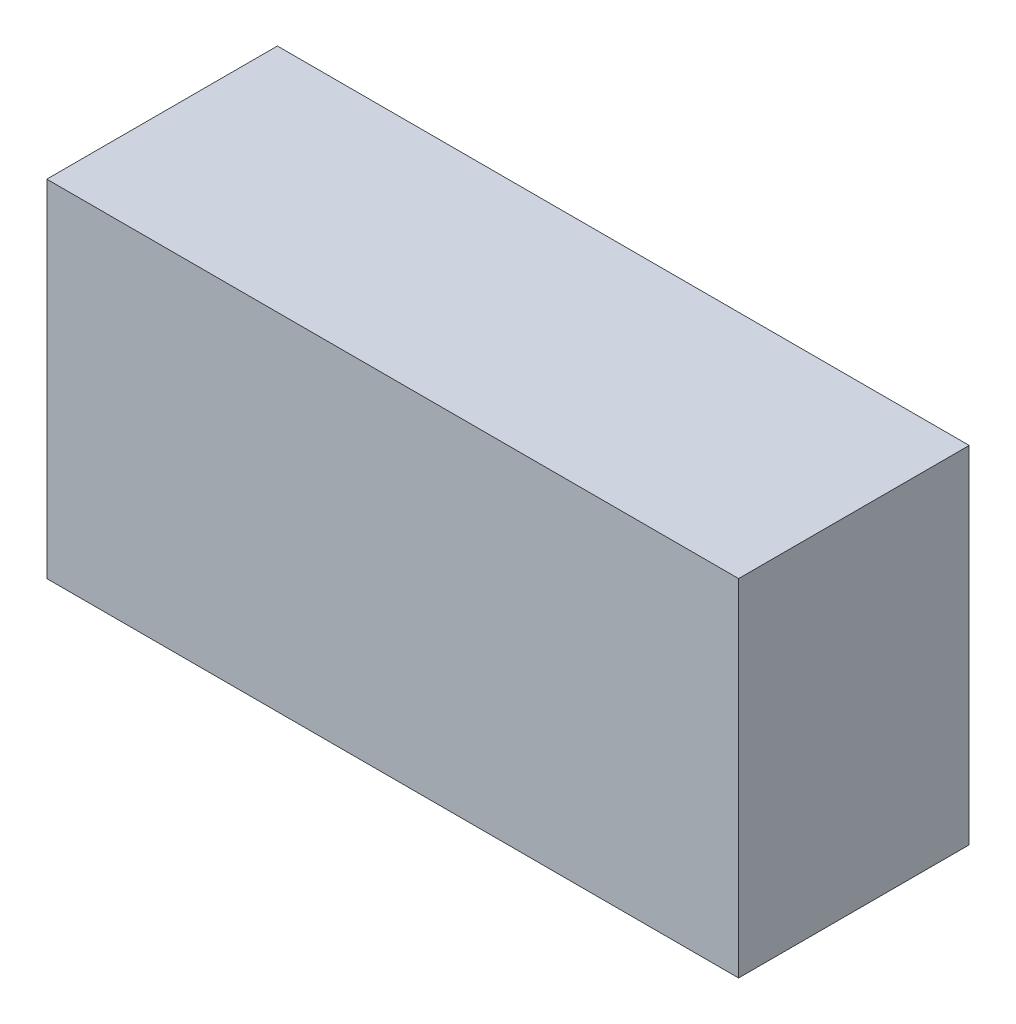
from build123d import *

# Parameters (mm, degrees)
SKETCH1_W           = 60
SKETCH1_H           = 30
BOSS_EXTRUDE1_DEPTH = 20


with BuildPart() as part:
    # Sketch1 → Boss-Extrude1 (new body)
    with BuildSketch(Plane.XY):
        with Locations((30, -15)):
            Rectangle(SKETCH1_W, SKETCH1_H)
    extrude(amount=BOSS_EXTRUDE1_DEPTH)


solid = part.part
